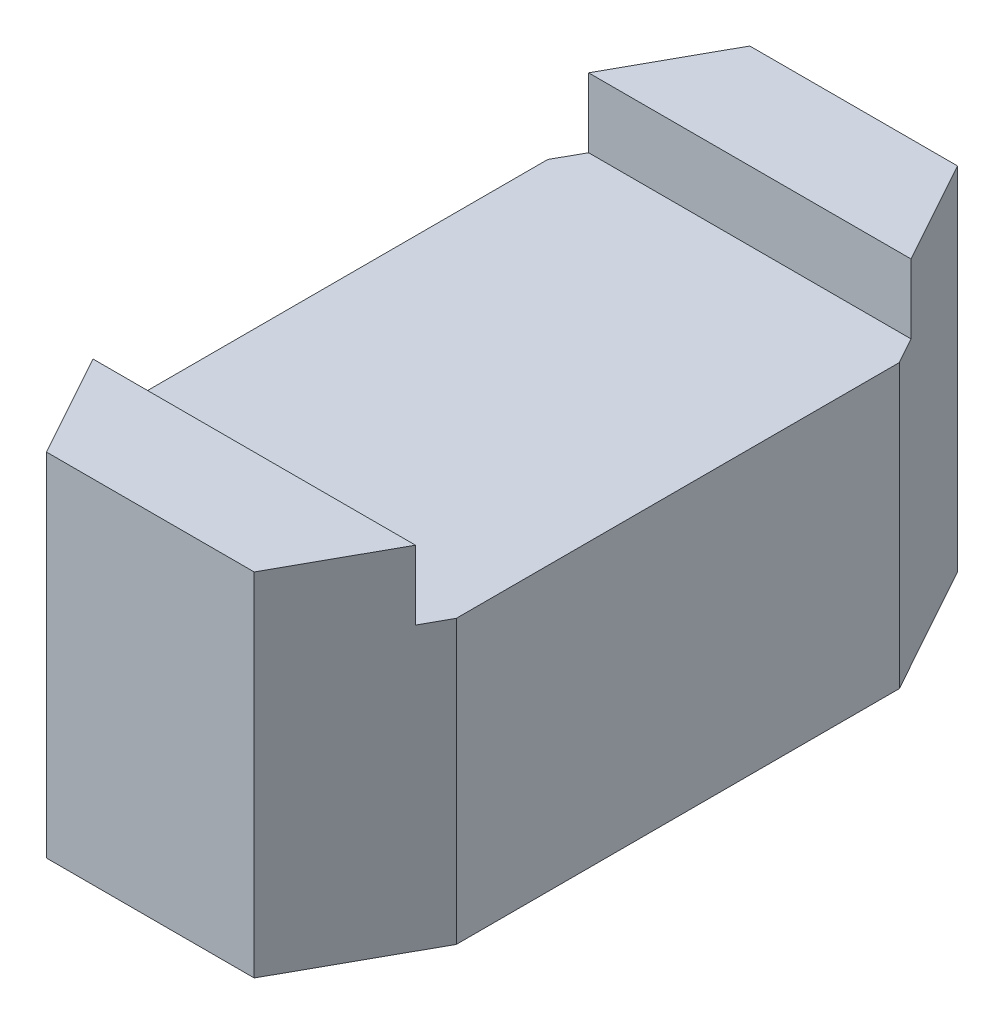
from build123d import *

# Parameters (mm, degrees)
EXTRUDE_1_DEPTH     = 2.54
SKETCH_2_W          = 2.54
SKETCH_2_H          = 3.58
CUT_EXTRUDE_1_DEPTH = 0.5


with BuildPart() as part:
    # Эскиз1 → Бобышка-Вытянуть1 (new body)
    with BuildSketch(Plane(origin=(0, 0, 0), x_dir=(1, 0, 0), z_dir=(0, 1, 0))):
        Polygon((-0.75, 2.54), (-1.27, 1.6), (-1.27, -1.6), (-0.75, -2.54), (0.75, -2.54), (1.27, -1.6), (1.27, 1.6), (0.75, 2.54), align=None)
    extrude(amount=EXTRUDE_1_DEPTH)

    # Эскиз2 → Вырез-Вытянуть1 (cut)
    with BuildSketch(Plane(origin=(0, 2.54, 0), x_dir=(1, 0, 0), z_dir=(0, 1, 0))):
        Rectangle(SKETCH_2_W, SKETCH_2_H)
    extrude(amount=-CUT_EXTRUDE_1_DEPTH, mode=Mode.SUBTRACT)


solid = part.part
